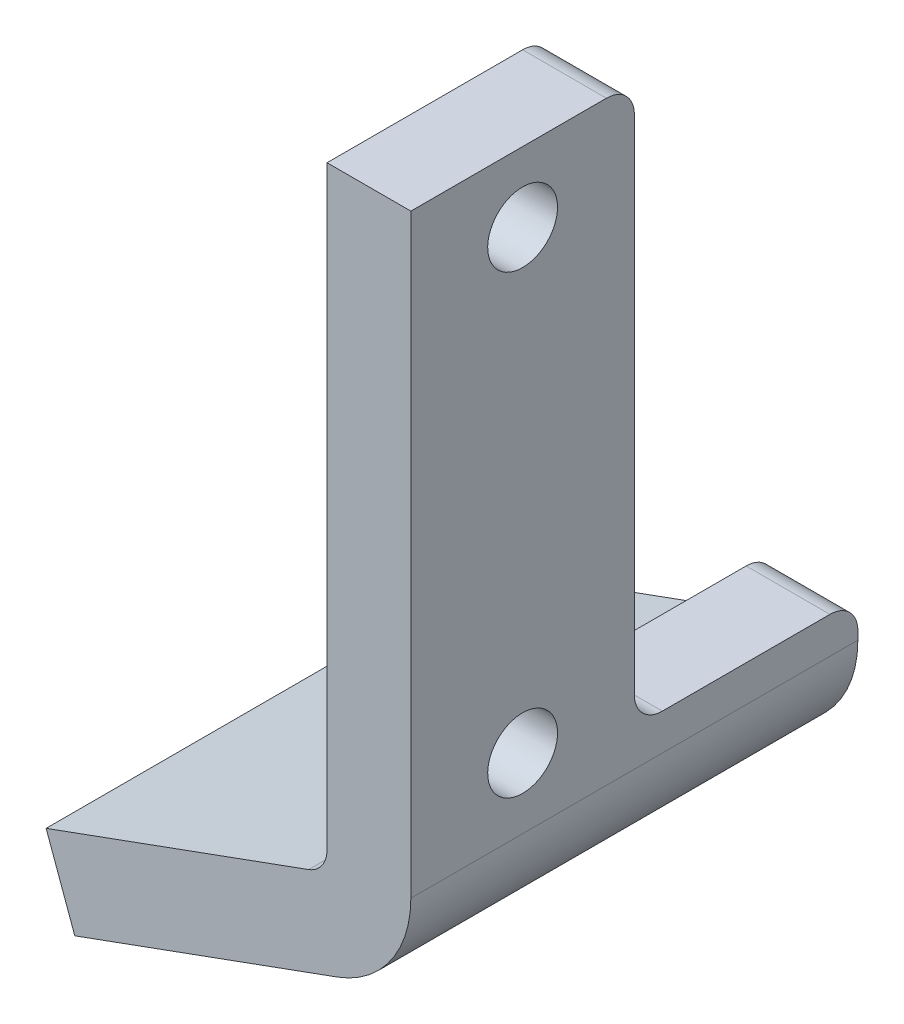
from build123d import *

# Parameters (mm, degrees)
BOSS_EXTRUDE2_DEPTH = 16
SKETCH7_R           = 2.25
CUT_EXTRUDE4_DEPTH  = 30.201645329
SKETCH6_R           = 1.25
SKETCH6_W           = 8
SKETCH6_H           = 20
CUT_EXTRUDE5_DEPTH  = 28.734295303
FILLET2_R           = 1


with BuildPart() as part:
    # Sketch2 → Boss-Extrude2 (new body)
    with BuildSketch(Plane.XY):
        with BuildLine():
            Line((-2.157979857, -1.939692621), (-11.554906065, -5.359894054))
            Line((-11.554906065, -5.359894054), (-10.528845635, -8.178971916))
            Line((-10.528845635, -8.178971916), (-1.131919427, -4.758770483))
            ThreePointArc((-1.131919427, -4.758770483), (0.776608177, -3.294305745), (1.5, -1))
            Line((1.5, -1), (1.5, 20.3))
            Line((1.5, 20.3), (-1.5, 20.3))
            Line((-1.5, 20.3), (-1.5, -1))
            ThreePointArc((-1.5, -1), (-1.680847956, -1.573576436), (-2.157979857, -1.939692621))
        make_face()
    extrude(amount=-BOSS_EXTRUDE2_DEPTH)

    # Sketch7 → Cut-Extrude4 (cut, through all)
    with BuildSketch(Plane(origin=(0.370969502, -1.01923033, 0), x_dir=(0.9396926207859104, 0.34202014332566305, 0), z_dir=(-0.3420201433256631, 0.9396926207859105, 0))):
        with Locations(Location((-7.691251695, 11, 0), (0, 0, 180))):
            Circle(SKETCH7_R)
    extrude(amount=-CUT_EXTRUDE4_DEPTH, mode=Mode.SUBTRACT)

    # Sketch6 → Cut-Extrude5 (cut, through all)
    with BuildSketch(Plane.ZY.offset(1.5)):
        with Locations(Location((-4, 17.8, 0), (0, 0, 270))):
            Circle(SKETCH6_R)
        with Locations(Location((-4, 1.5, 0), (0, 0, 270))):
            Circle(SKETCH6_R)
        with Locations((-12, 10.3)):
            Rectangle(SKETCH6_W, SKETCH6_H)
    extrude(amount=-CUT_EXTRUDE5_DEPTH, mode=Mode.SUBTRACT)

    # Fillet2
    fillet2_edges = [part.edges().sort_by_distance(p)[0] for p in [
        (0, 0.3, -16),
        (0, 20.3, -8),
        (0, 0.3, -8),
    ]]
    fillet(fillet2_edges, radius=FILLET2_R)


solid = part.part
